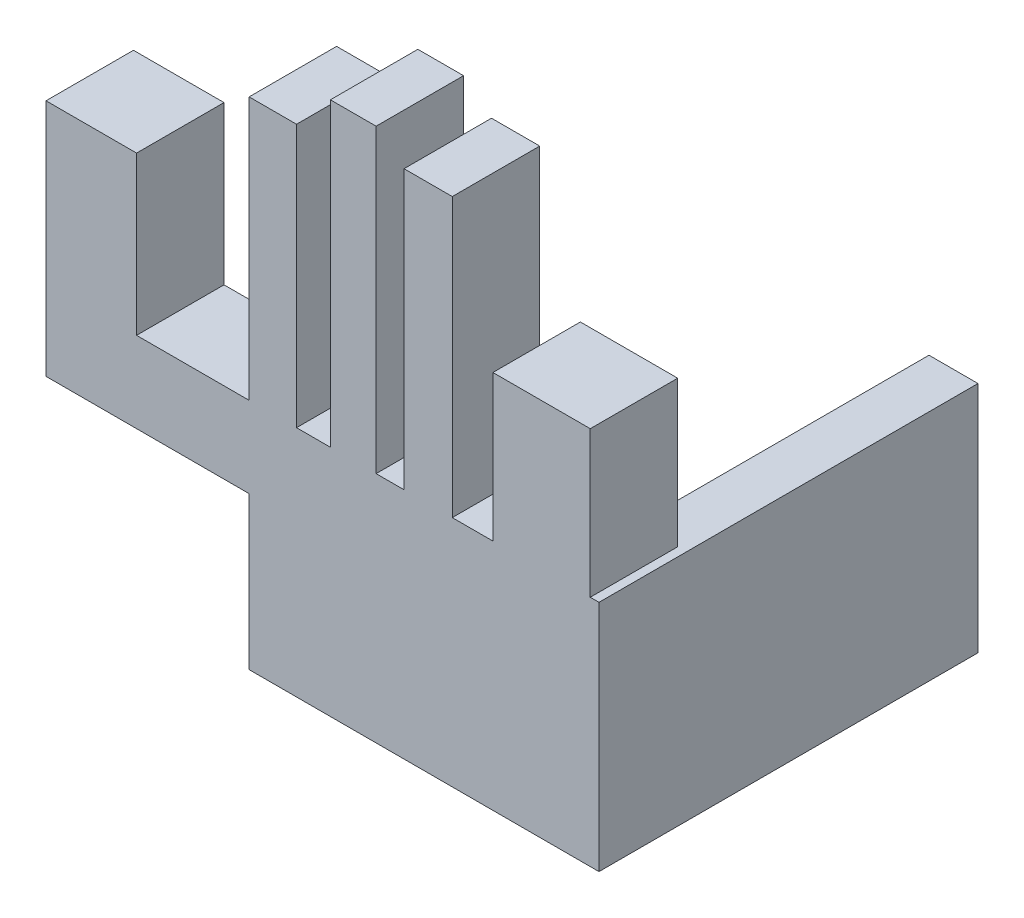
from build123d import *

# Parameters (mm, degrees)
BOSS_EXTRUDE1_DEPTH = 15
SKETCH2_W           = 8.404533339
SKETCH2_H           = 40
BOSS_EXTRUDE2_DEPTH = 50
SKETCH3_W           = 20
SKETCH3_H           = 6
CUT_EXTRUDE1_DEPTH  = 2


with BuildPart() as part:
    # Sketch1 → Boss-Extrude1 (new body)
    with BuildSketch(Plane.XY):
        Polygon((21.774193548, 0), (26.564516129, 0), (26.564516129, 47.685483871), (34.838709677, 47.685483871), (34.838709677, 0), (41.806451613, 0), (41.806451613, 25.040322581), (58.5, 25.040322581), (58.5, 0), (60, 0), (60, -40), (0, -40), (0, -13.862903226), (-34.838709677, -13.862903226), (-34.838709677, 0), (-34.838709677, 27.072580645), (-19.306451613, 27.072580645), (-19.306451613, 0), (0, 0), (0, 45.072580645), (8.129032258, 45.072580645), (8.129032258, 0), (13.935483871, 0), (13.935483871, 51.60483871), (21.774193548, 51.60483871), align=None)
    extrude(amount=BOSS_EXTRUDE1_DEPTH)

    # Sketch2 → Boss-Extrude2 (add)
    with BuildSketch(Plane(origin=(0, 0, 0), x_dir=(-1, 0, 0), z_dir=(0, 0, -1))):
        with Locations((-55.797733331, -20)):
            Rectangle(SKETCH2_W, SKETCH2_H)
    extrude(amount=BOSS_EXTRUDE2_DEPTH)

    # Sketch3 → Cut-Extrude1 (cut)
    with BuildSketch(Plane.ZY.offset(-51.595466661)):
        with Locations((-25.300512309, -19.08245708)):
            Rectangle(SKETCH3_W, SKETCH3_H)
    extrude(amount=-CUT_EXTRUDE1_DEPTH, mode=Mode.SUBTRACT)


solid = part.part
